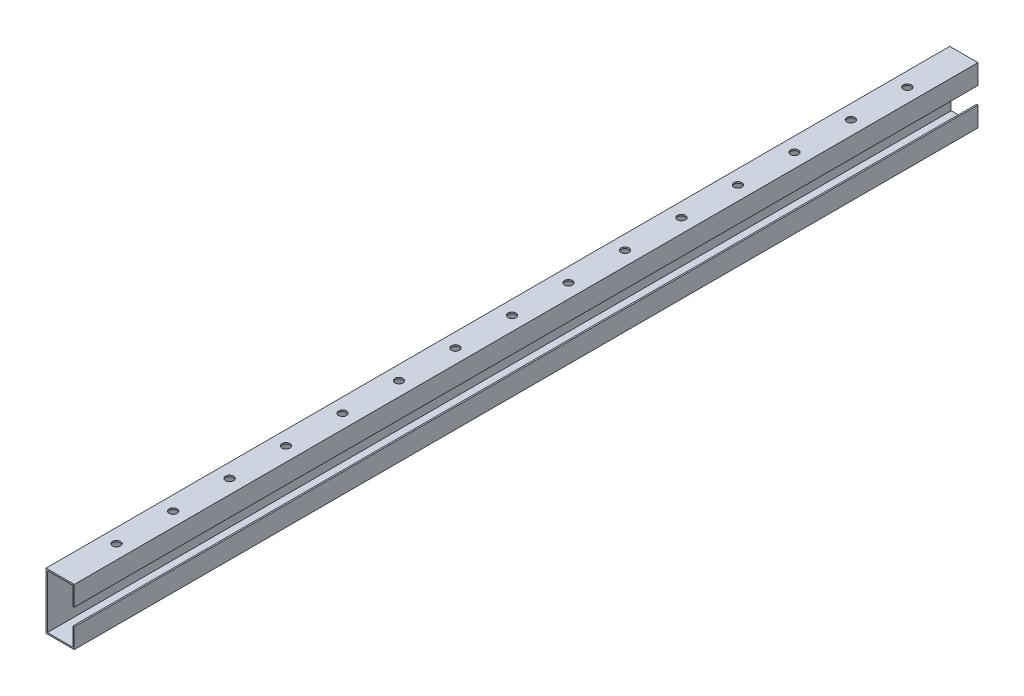
from build123d import *

# Parameters (mm, degrees)
CROQUIS1_W              = 50
CROQUIS1_H              = 100
CROQUIS1_W_2            = 45
CROQUIS1_H_2            = 95
SALIENTE_EXTRUIR1_DEPTH = 800
CROQUIS2_W              = 1600
CROQUIS2_H              = 30
CORTAR_EXTRUIR1_DEPTH   = 5
CROQUIS8_R              = 7.14375
CORTAR_EXTRUIR2_DEPTH   = 130


with BuildPart() as part:
    # Croquis1 → Saliente-Extruir1 (new, symmetric)
    with BuildSketch(Plane.XY):
        Rectangle(CROQUIS1_W, CROQUIS1_H)
        Rectangle(CROQUIS1_W_2, CROQUIS1_H_2, mode=Mode.SUBTRACT)
    extrude(amount=SALIENTE_EXTRUIR1_DEPTH, both=True)

    # Croquis2 → Cortar-Extruir1 (cut)
    with BuildSketch(Plane(origin=(25, 0, 0), x_dir=(0, 0, -1), z_dir=(1, 0, 0))):
        Rectangle(CROQUIS2_W, CROQUIS2_H)
    extrude(amount=-CORTAR_EXTRUIR1_DEPTH, mode=Mode.SUBTRACT)

    # Croquis8 → Cortar-Extruir2 (cut)
    with BuildSketch(Plane(origin=(25, 50, 0), x_dir=(0, 0, 1), z_dir=(0, -1, 0))):
        with Locations(Location((0, 25, 0), (0, 0, 180))):
            Circle(CROQUIS8_R)
        with Locations(Location((100, 25, 0), (0, 0, 180))):
            Circle(CROQUIS8_R)
        with Locations(Location((200, 25, 0), (0, 0, 180))):
            Circle(CROQUIS8_R)
        with Locations(Location((300, 25, 0), (0, 0, 180))):
            Circle(CROQUIS8_R)
        with Locations(Location((400, 25, 0), (0, 0, 180))):
            Circle(CROQUIS8_R)
        with Locations(Location((500, 25, 0), (0, 0, 180))):
            Circle(CROQUIS8_R)
        with Locations(Location((600, 25, 0), (0, 0, 180))):
            Circle(CROQUIS8_R)
        with Locations(Location((700, 25, 0), (0, 0, 180))):
            Circle(CROQUIS8_R)
        with Locations(Location((-100, 25, 0), (0, 0, 180))):
            Circle(CROQUIS8_R)
        with Locations(Location((-200, 25, 0), (0, 0, 180))):
            Circle(CROQUIS8_R)
        with Locations(Location((-300, 25, 0), (0, 0, 180))):
            Circle(CROQUIS8_R)
        with Locations(Location((-400, 25, 0), (0, 0, 180))):
            Circle(CROQUIS8_R)
        with Locations(Location((-500, 25, 0), (0, 0, 180))):
            Circle(CROQUIS8_R)
        with Locations(Location((-600, 25, 0), (0, 0, 180))):
            Circle(CROQUIS8_R)
        with Locations(Location((-700, 25, 0), (0, 0, 180))):
            Circle(CROQUIS8_R)
    extrude(amount=CORTAR_EXTRUIR2_DEPTH, mode=Mode.SUBTRACT)


solid = part.part
